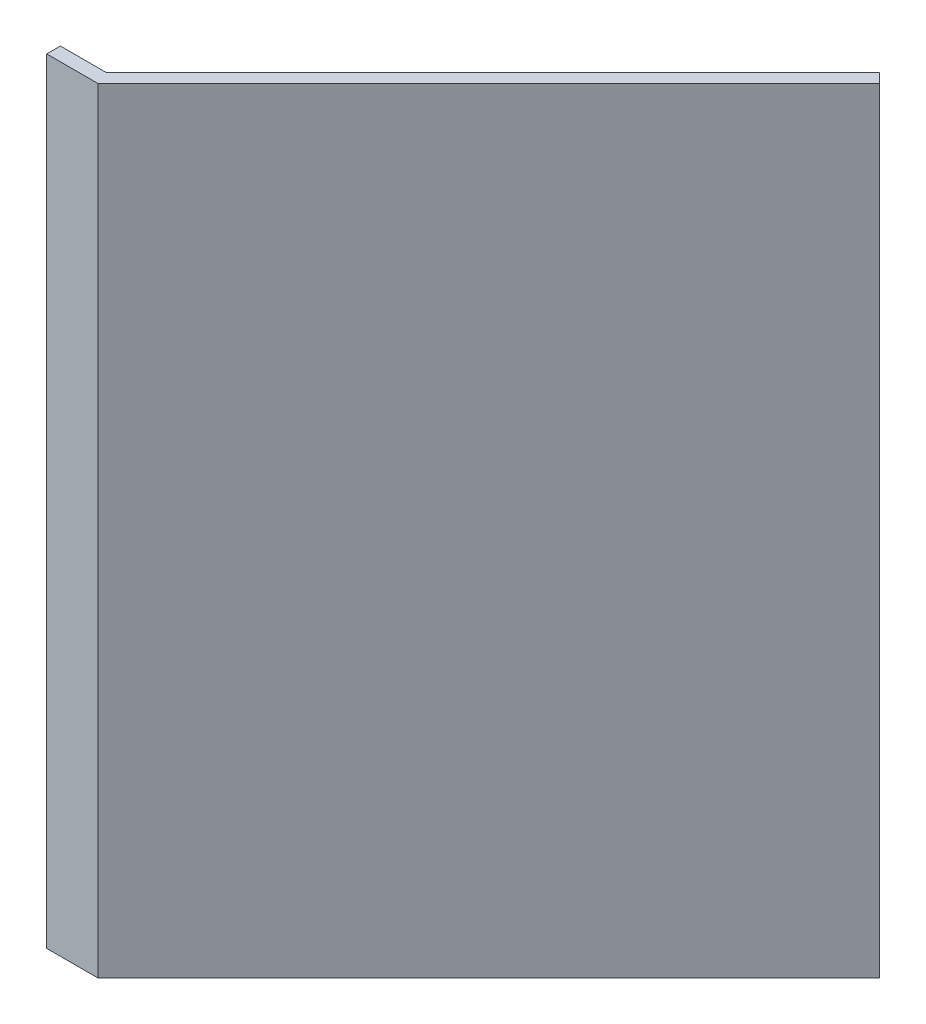
from build123d import *

# Parameters (mm, degrees)
SKETCH_1_W      = 10
SKETCH_1_H      = 3
EXTRUDE_1_DEPTH = 170


with BuildPart() as part:
    # 草图1 → 凸台-拉伸1 (new body)
    with BuildSketch(Plane(origin=(0, 0, 0), x_dir=(1, 0, 0), z_dir=(0, 1, 0))):
        Polygon((-69.608677765, -77.709177727), (-70.851318452, -77.709177727), (-70.851318452, -74.709177727), (14.001495291, 10.143636016), (16.122815634, 8.022315672), align=None)
        with Locations((-75.851318452, -76.209177727)):
            Rectangle(SKETCH_1_W, SKETCH_1_H)
    extrude(amount=EXTRUDE_1_DEPTH)


solid = part.part
